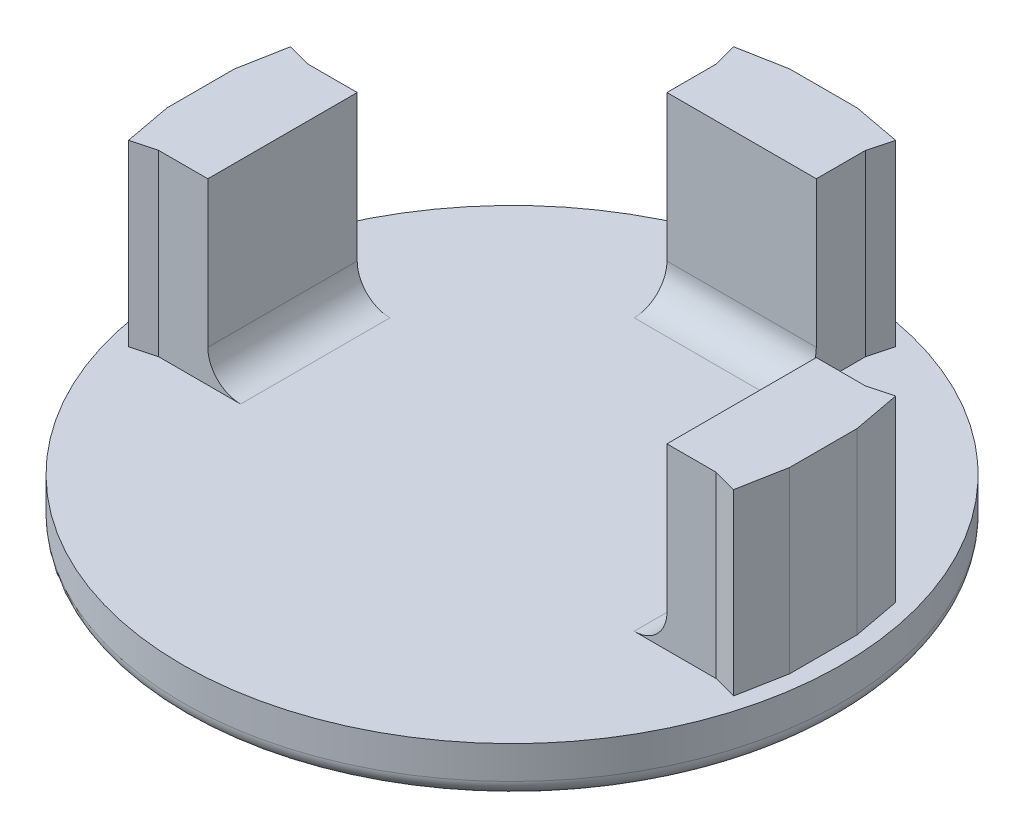
from build123d import *

# Parameters (mm, degrees)
SKETCH2_R           = 20.1
BOSS_EXTRUDE2_DEPTH = 3
BOSS_EXTRUDE4_DEPTH = 10.9
FILLET1_R           = 2
FILLET2_R           = 1


with BuildPart() as part:
    # Sketch2 → Boss-Extrude2 (new body)
    with BuildSketch(Plane(origin=(0, 0, 0), x_dir=(1, 0, 0), z_dir=(0, 1, 0))):
        with Locations(Location((0, 0, 0), (0, 0, 270))):
            Circle(SKETCH2_R)
    extrude(amount=BOSS_EXTRUDE2_DEPTH)

    # Sketch3 → Boss-Extrude4 (add)
    with BuildSketch(Plane(origin=(0, 3, 0), x_dir=(1, 0, 0), z_dir=(0, 1, 0))):
        Polygon((-4.943443761, 18.449183282), (-4.555215194, 17.000294543), (-4.555215194, 14.000294543), (4.555215194, 14.000294543), (4.555215194, 17.000294543), (4.943443761, 18.449183282), (2.054487352, 18.989183282), (-2.054487352, 18.989183282), align=None)
        Polygon((17.000294543, 4.555215194), (14.000294543, 4.555215194), (14.000294543, -4.555215194), (17.000294543, -4.555215194), (18.449183282, -4.943443761), (18.989183282, -2.054487352), (18.989183282, 2.054487352), (18.449183282, 4.943443761), align=None)
        Polygon((-17.000294543, -4.555215194), (-14.000294543, -4.555215194), (-14.000294543, 4.555215194), (-17.000294543, 4.555215194), (-18.449183282, 4.943443761), (-18.989183282, 2.054487352), (-18.989183282, -2.054487352), (-18.449183282, -4.943443761), align=None)
    extrude(amount=BOSS_EXTRUDE4_DEPTH)

    # Fillet1
    fillet1_edges = [part.edges().sort_by_distance(p)[0] for p in [
        (-14.000294543, 3, 0),
        (14.000294543, 3, 0),
        (0, 3, -14.000294543),
    ]]
    fillet(fillet1_edges, radius=FILLET1_R)

    # Fillet2
    fillet2_edges = [part.edges().sort_by_distance(p)[0] for p in [
        (0, 0, -20.1),
    ]]
    fillet(fillet2_edges, radius=FILLET2_R)


solid = part.part
